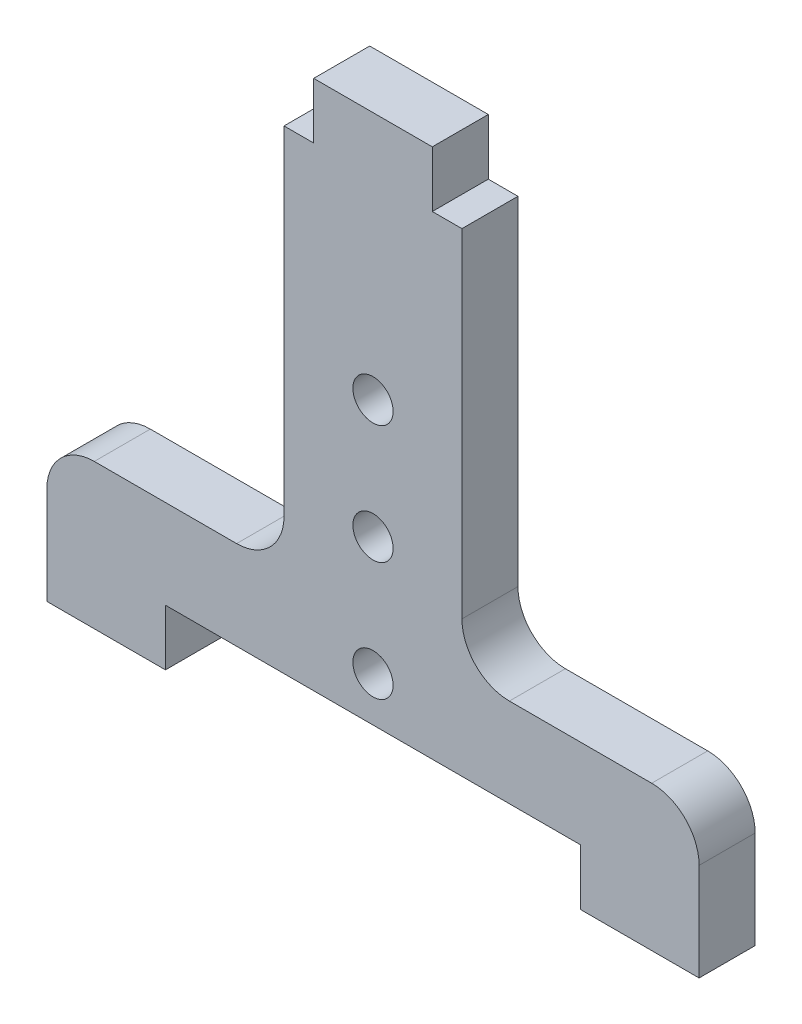
from build123d import *

# Parameters (mm, degrees)
SKETCH1_W             = 69.85
SKETCH1_H             = 50.8
BASE_DEPTH            = 5.999988
SKETCH6_W             = 12.7
SKETCH6_H             = 5.999988
BOSS_EXTRUDE1_DEPTH   = 5.999988
SKETCH7_W             = 25.4
SKETCH7_H             = 41.275
CUT_EXTRUDE1_DEPTH    = 48.346749914
F_8_CLEARANCE_HOLE1_D = 4.3053
SKETCH8_W             = 25.4
SKETCH8_H             = 41.275
CUT_EXTRUDE2_DEPTH    = 48.346749914
FILLET1_R             = 5.08


with BuildPart() as part:
    # Sketch1 → Base (new body)
    with BuildSketch(Plane.XY):
        Rectangle(SKETCH1_W, SKETCH1_H)
    extrude(amount=BASE_DEPTH)

    # Sketch6 → Boss-Extrude1 (add)
    with BuildSketch(Plane.XY.offset(5.999988)):
        with Locations((0, 28.399994)):
            Rectangle(SKETCH6_W, SKETCH6_H)
        with Locations((28.575, -28.399994)):
            Rectangle(SKETCH6_W, SKETCH6_H)
        with Locations((-28.575, -28.399994)):
            Rectangle(SKETCH6_W, SKETCH6_H)
    extrude(amount=-BOSS_EXTRUDE1_DEPTH)

    # Sketch7 → Cut-Extrude1 (cut, through all)
    with BuildSketch(Plane.XY.offset(5.999988)):
        with Locations((-22.225, 4.7625)):
            Rectangle(SKETCH7_W, SKETCH7_H)
    extrude(amount=-CUT_EXTRUDE1_DEPTH, mode=Mode.SUBTRACT)

    # #8 Clearance Hole1 (through all)
    with Locations(Plane(origin=(0, 0, 0), x_dir=(-1, 0, 0), z_dir=(0, 0, -1))):
        with Locations((0, -20.6375), (0, -7.9375), (0, 4.7625)):
            Hole(F_8_CLEARANCE_HOLE1_D / 2)

    # Sketch8 → Cut-Extrude2 (cut, through all)
    with BuildSketch(Plane.XY.offset(5.999988)):
        with Locations((22.225, 4.7625)):
            Rectangle(SKETCH8_W, SKETCH8_H)
    extrude(amount=-CUT_EXTRUDE2_DEPTH, mode=Mode.SUBTRACT)

    # Fillet1
    fillet1_edges = [part.edges().sort_by_distance(p)[0] for p in [
        (34.925, -15.875, 2.999994),
        (9.525, -15.875, 2.999994),
        (-9.525, -15.875, 2.999994),
        (-34.925, -15.875, 2.999994),
    ]]
    fillet(fillet1_edges, radius=FILLET1_R)


solid = part.part
